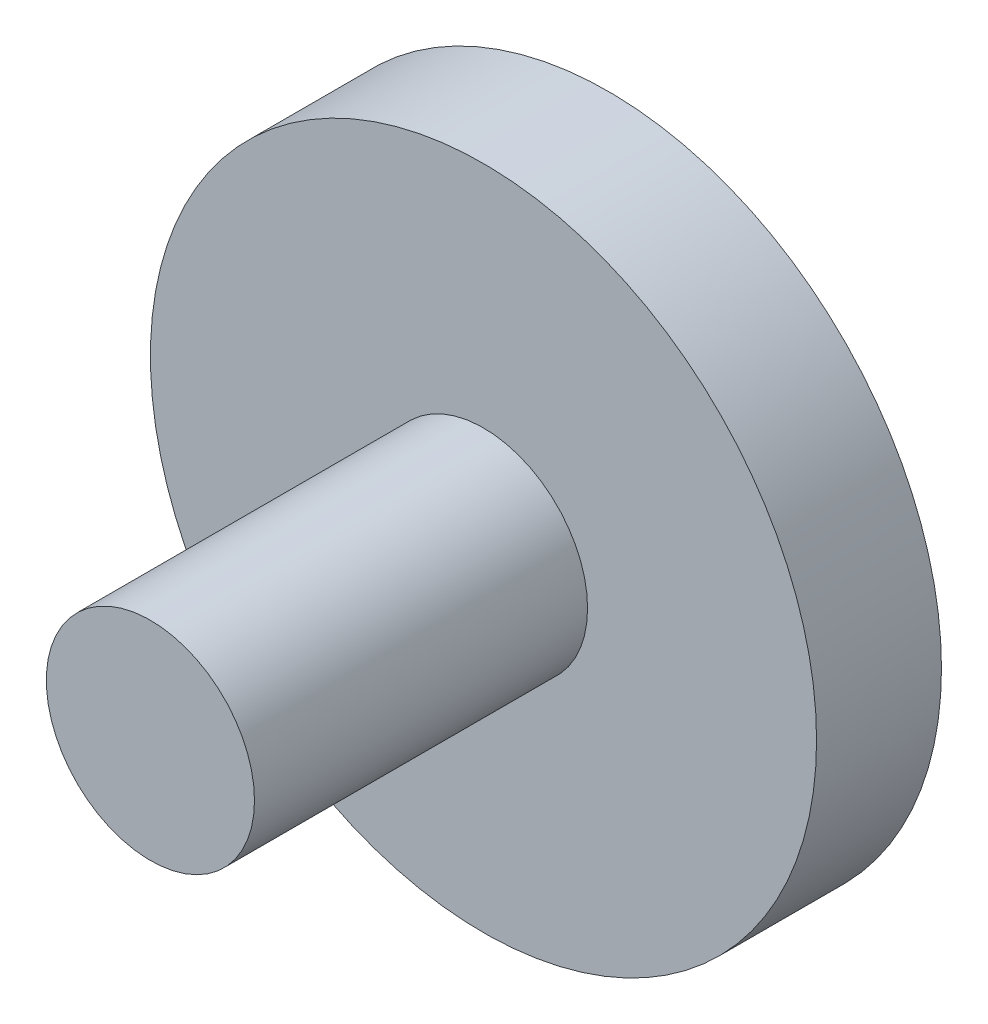
from build123d import *

# Parameters (mm, degrees)
F_01_START                          = -3
S01_LOW_FLANGED_HEAD_R              = 8
F_01_LOW_FLANGED_HEAD_DEPTH         = 3
S02_M5_THREAD_MAJOR_DIAMETER_R      = 2.5
F_02_M5_THREAD_MAJOR_DIAMETER_DEPTH = 8
F_03_START                          = -3.1
F_03_DRIVE_HEX_DEPTH                = 1.7


with BuildPart() as part:
    # S01 - Low flanged head → 01 - Low flanged head (new body)
    with BuildSketch(Plane.XY.offset(F_01_START)):
        Circle(S01_LOW_FLANGED_HEAD_R)
    extrude(amount=F_01_LOW_FLANGED_HEAD_DEPTH)

    # S02 - M5 thread major diameter → 02 - M5 thread major diameter (add)
    with BuildSketch(Plane.XY):
        Circle(S02_M5_THREAD_MAJOR_DIAMETER_R)
    extrude(amount=F_02_M5_THREAD_MAJOR_DIAMETER_DEPTH)

    # S03 - Drive hex → 03 - Drive hex (cut)
    with BuildSketch(Plane.XY.offset(F_03_START)):
        Polygon((1.732050808, 0), (0.866025404, 1.5), (-0.866025404, 1.5), (-1.732050808, 0), (-0.866025404, -1.5), (0.866025404, -1.5), align=None)
    extrude(amount=F_03_DRIVE_HEX_DEPTH, mode=Mode.SUBTRACT)


solid = part.part
